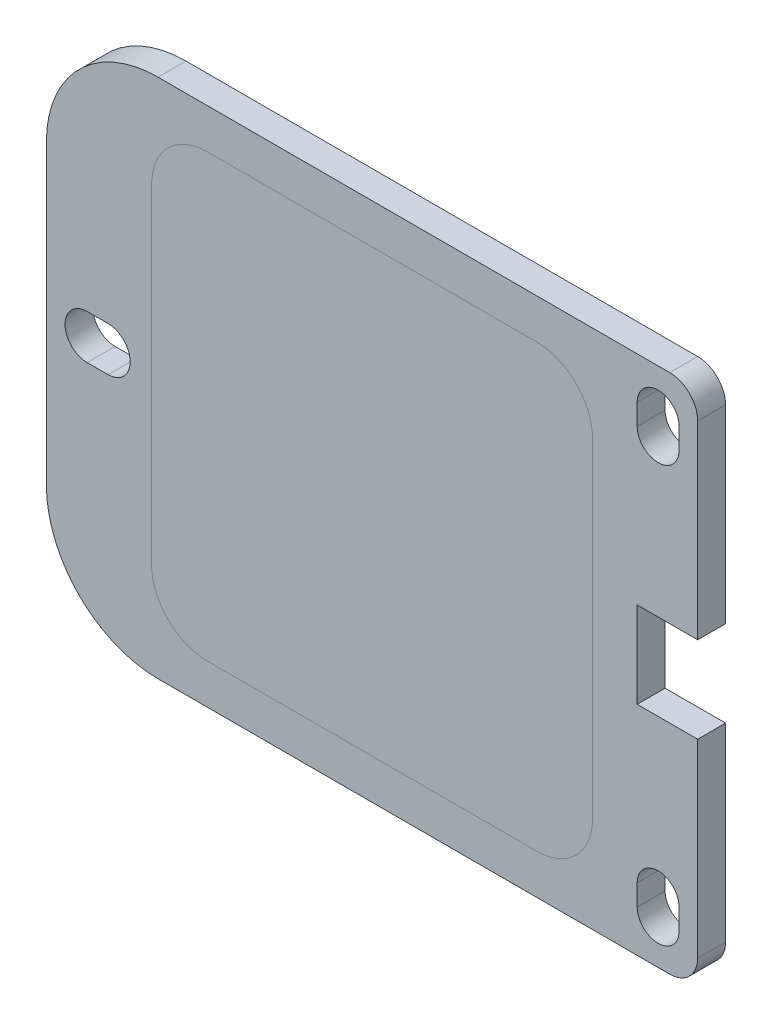
from build123d import *

# Parameters (mm, degrees)
BOSS_EXTRUDE1_DEPTH = 19.05
FILLET1_R           = 76.2
FILLET2_R           = 19.05


with BuildPart() as part:
    # Sketch1 → Boss-Extrude1 (new body)
    with BuildSketch(Plane.XY):
        Polygon((-222.25, -177.8), (222.25, -177.8), (222.25, -29.36875), (180.975, -29.36875), (180.975, 29.36875), (222.25, 29.36875), (222.25, 177.8), (-222.25, 177.8), align=None)
        with BuildLine():
            Line((-194.4624, 15.08125), (-180.1749, 15.08125))
            ThreePointArc((-180.1749, 15.08125), (-165.09365, 0), (-180.1749, -15.08125))
            Line((-180.1749, -15.08125), (-194.4624, -15.08125))
            ThreePointArc((-194.4624, -15.08125), (-209.54365, 0), (-194.4624, 15.08125))
        make_face(mode=Mode.SUBTRACT)
        with BuildLine():
            Line((209.55, -134.9248), (209.55, -149.225))
            ThreePointArc((209.55, -149.225), (195.2625, -163.5125), (180.975, -149.225))
            Line((180.975, -149.225), (180.975, -134.9248))
            ThreePointArc((180.975, -134.9248), (195.2625, -120.6373), (209.55, -134.9248))
        make_face(mode=Mode.SUBTRACT)
        with BuildLine():
            Line((209.55, 134.9248), (209.55, 149.225))
            ThreePointArc((209.55, 149.225), (195.2625, 163.5125), (180.975, 149.225))
            Line((180.975, 149.225), (180.975, 134.9248))
            ThreePointArc((180.975, 134.9248), (195.2625, 120.6373), (209.55, 134.9248))
        make_face(mode=Mode.SUBTRACT)
    extrude(amount=BOSS_EXTRUDE1_DEPTH)

    # Fillet1
    fillet1_edges = [part.edges().sort_by_distance(p)[0] for p in [
        (-222.25, -177.8, 9.525),
        (-222.25, 177.8, 9.525),
    ]]
    fillet(fillet1_edges, radius=FILLET1_R)

    # Fillet2
    fillet2_edges = [part.edges().sort_by_distance(p)[0] for p in [
        (222.25, -177.8, 9.525),
        (222.25, 177.8, 9.525),
    ]]
    fillet(fillet2_edges, radius=FILLET2_R)


solid = part.part
